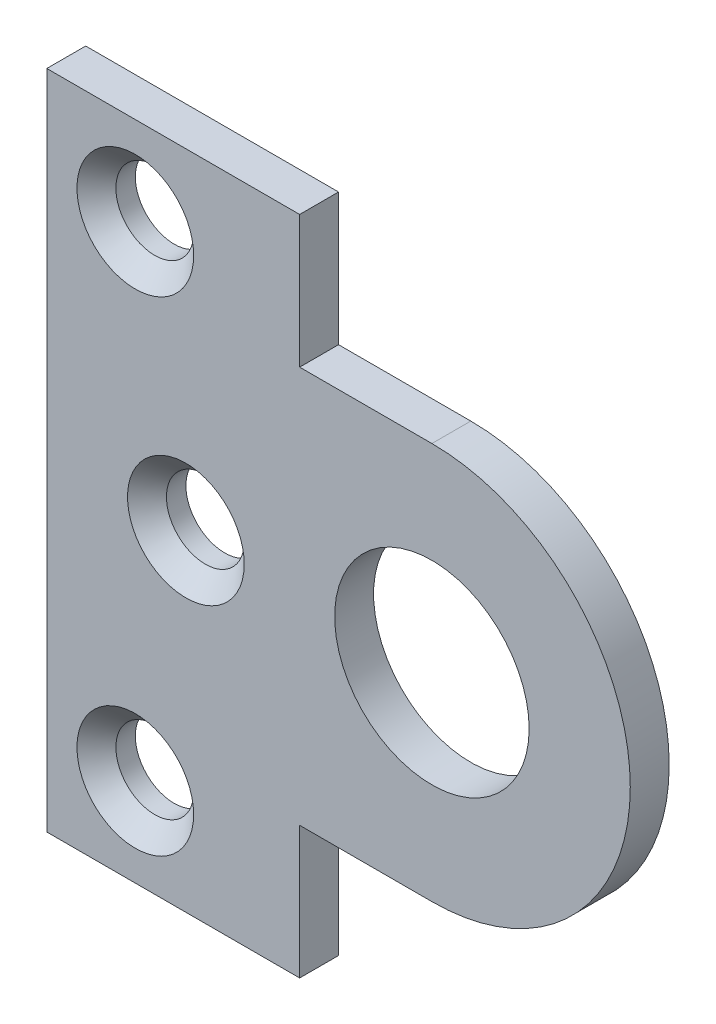
from build123d import *

# Parameters (mm, degrees)
SKETCH1_R           = 7.9375
SKETCH1_R_2         = 3.175
BOSS_EXTRUDE1_DEPTH = 3.175
CHAMFER1_SIZE       = 1.5875


with BuildPart() as part:
    # Sketch1 → Boss-Extrude1 (new body)
    with BuildSketch(Plane.XY):
        with BuildLine():
            Line((0, 16.1925), (-10.795, 16.1925))
            Line((-10.795, 16.1925), (-10.795, 26.9875))
            Line((-10.795, 26.9875), (-31.4325, 26.9875))
            Line((-31.4325, 26.9875), (-31.4325, -26.9875))
            Line((-31.4325, -26.9875), (-10.795, -26.9875))
            Line((-10.795, -26.9875), (-10.795, -16.1925))
            Line((-10.795, -16.1925), (0, -16.1925))
            ThreePointArc((0, -16.1925), (16.1925, 0), (0, 16.1925))
        make_face()
        Circle(SKETCH1_R, mode=Mode.SUBTRACT)
        with Locations((-24.209375, 19.764375)):
            Circle(SKETCH1_R_2, mode=Mode.SUBTRACT)
        with Locations((-20.081875, 0)):
            Circle(SKETCH1_R_2, mode=Mode.SUBTRACT)
        with Locations((-24.209375, -19.764375)):
            Circle(SKETCH1_R_2, mode=Mode.SUBTRACT)
    extrude(amount=BOSS_EXTRUDE1_DEPTH)

    # Chamfer1
    chamfer1_edges = [part.edges().sort_by_distance(p)[0] for p in [
        (-27.384375, 19.764375, 3.175),
        (-23.256875, 0, 3.175),
        (-27.384375, -19.764375, 3.175),
    ]]
    chamfer(chamfer1_edges, length=CHAMFER1_SIZE)


solid = part.part
